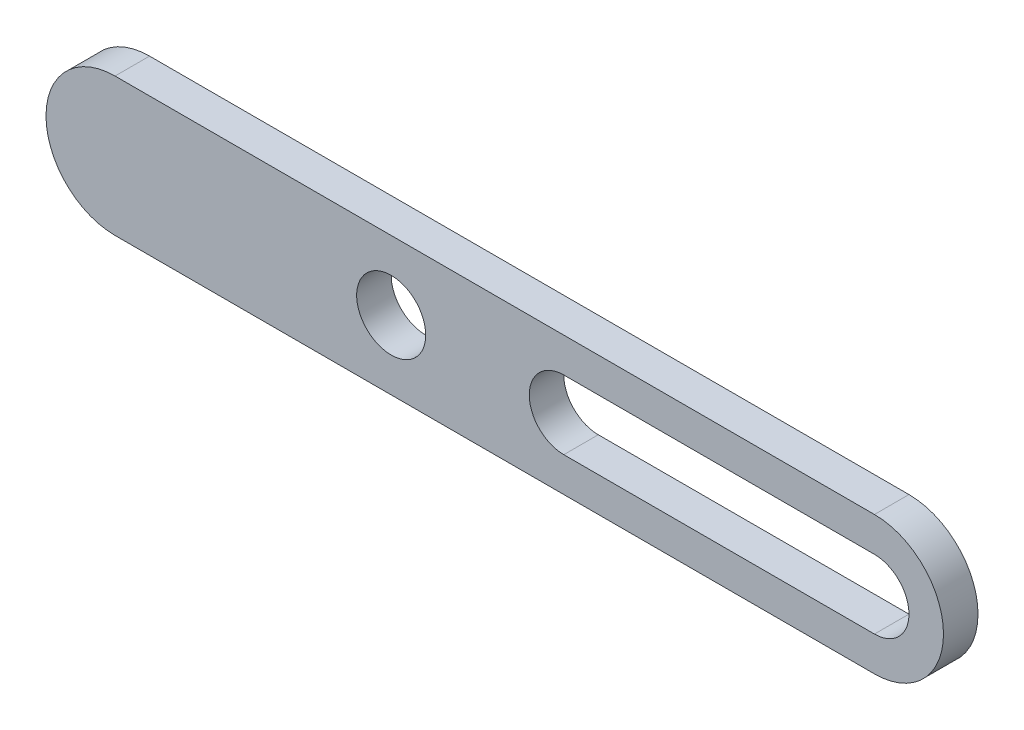
from build123d import *

# Parameters (mm, degrees)
SKETCH1_R           = 12.7
BOSS_EXTRUDE1_DEPTH = 12.7


with BuildPart() as part:
    # Sketch1 → Boss-Extrude1 (new body)
    with BuildSketch(Plane.XY):
        with BuildLine():
            Line((-88.9, 25.4), (88.9, 25.4))
            ThreePointArc((88.9, 25.4), (114.3, 0), (88.9, -25.4))
            Line((88.9, -25.4), (-88.9, -25.4))
            Line((-88.9, -25.4), (-190.5, -25.4))
            ThreePointArc((-190.5, -25.4), (-215.9, 0), (-190.5, 25.4))
            Line((-190.5, 25.4), (-88.9, 25.4))
        make_face()
        with Locations((-88.9, 0)):
            Circle(SKETCH1_R, mode=Mode.SUBTRACT)
        with BuildLine():
            Line((88.9, 12.7), (-25.4, 12.7))
            ThreePointArc((-25.4, 12.7), (-38.1, 0), (-25.4, -12.7))
            Line((-25.4, -12.7), (88.9, -12.7))
            ThreePointArc((88.9, -12.7), (101.6, 0), (88.9, 12.7))
        make_face(mode=Mode.SUBTRACT)
    extrude(amount=BOSS_EXTRUDE1_DEPTH)


solid = part.part
